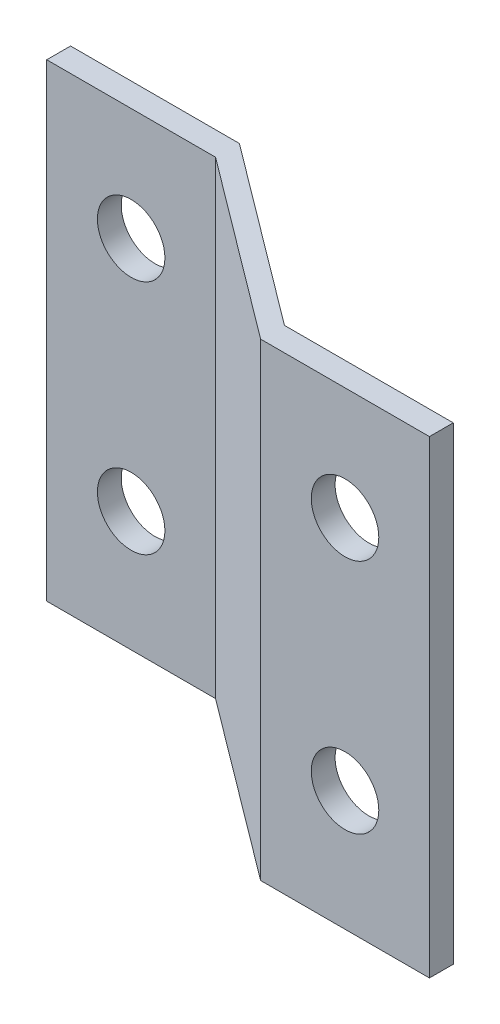
from build123d import *

# Parameters (mm, degrees)
BOSS_EXTRUDE1_DEPTH = 125
SKETCH4_R           = 9
CUT_EXTRUDE1_DEPTH  = 152.817765536
SKETCH5_R           = 9
CUT_EXTRUDE2_DEPTH  = 154.447072098


with BuildPart() as part:
    # Sketch1 → Boss-Extrude1 (new body)
    with BuildSketch(Plane(origin=(0, 0, 0), x_dir=(1, 0, 0), z_dir=(0, 1, 0))):
        Polygon((-78.284726088, 35.987992356), (-78.284726088, 29.637992356), (-33.284726088, 29.637992356), (14.724277299, -6.35), (59.724277299, -6.35), (59.724277299, 0), (14.724277299, 0), (-33.284726088, 35.987992356), align=None)
    extrude(amount=BOSS_EXTRUDE1_DEPTH)

    # Sketch4 → Cut-Extrude1 (cut, through all)
    with BuildSketch(Plane.XY.offset(-29.637992356)):
        with Locations((-55.784726088, 95)):
            Circle(SKETCH4_R)
        with Locations((-55.784726088, 32)):
            Circle(SKETCH4_R)
    extrude(amount=-CUT_EXTRUDE1_DEPTH, mode=Mode.SUBTRACT)

    # Sketch5 → Cut-Extrude2 (cut, through all)
    with BuildSketch(Plane.XY.offset(6.35)):
        with Locations((37.224277299, 95)):
            Circle(SKETCH5_R)
        with Locations((37.224277299, 32)):
            Circle(SKETCH5_R)
    extrude(amount=-CUT_EXTRUDE2_DEPTH, mode=Mode.SUBTRACT)


solid = part.part
